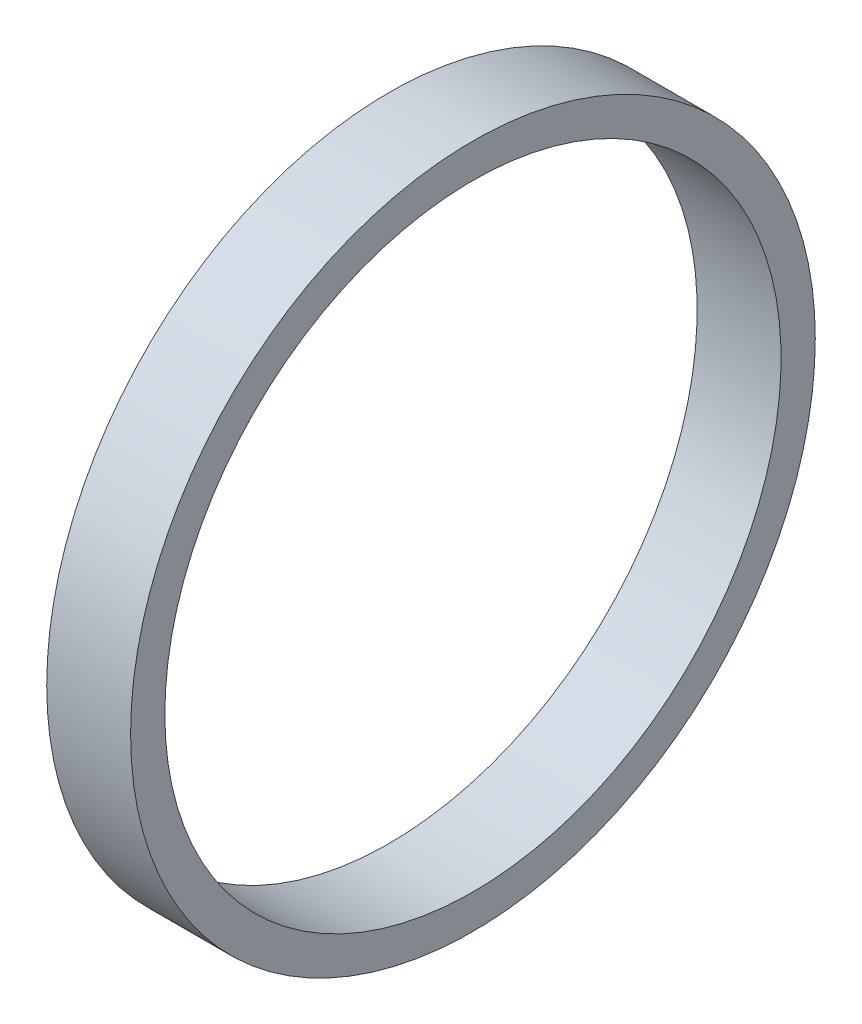
from build123d import *


with BuildPart() as part:
    # Sketch1 → Revolve1 (revolve)
    with BuildSketch(Plane.XY, mode=Mode.PRIVATE) as revolve1_sk:
        Polygon((0, 90), (12.25, 90), (12.25, 100), (-12.25, 100), (-12.25, 90), align=None)
    revolve(revolve1_sk.sketch.rotate(Axis((0, 0, 0), (1, 0, 0)), 90), axis=Axis((0, 0, 0), (1, 0, 0)))


solid = part.part
